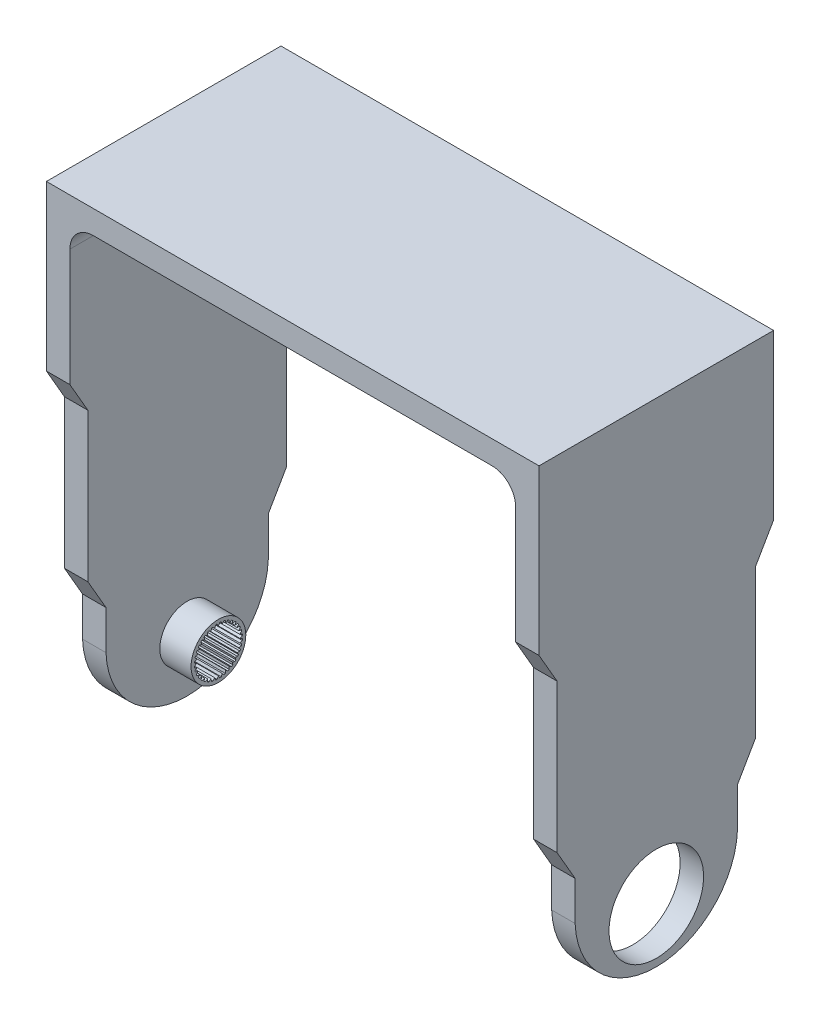
from build123d import *

# Parameters (mm, degrees)
SKETCH1_W            = 63
SKETCH1_H            = 30
BOSS_EXTRUDE1_DEPTH  = 3
SKETCH2_W            = 3
SKETCH2_H            = 30
BOSS_EXTRUDE2_DEPTH  = 60
BOSS_EXTRUDE3_DEPTH  = 4
CUT_EXTRUDE1_DEPTH   = 5
CUT_EXTRUDE2_DEPTH   = 4
FILLET1_R            = 3
FILLET1_OF_MIRROR1_R = 3
SKETCH9_R            = 6.05
CUT_EXTRUDE3_DEPTH   = 10


with BuildPart() as part:
    # Sketch1 → Boss-Extrude1 (new body)
    with BuildSketch(Plane(origin=(0, 0, 0), x_dir=(1, 0, 0), z_dir=(0, 1, 0))):
        Rectangle(SKETCH1_W, SKETCH1_H)
    extrude(amount=BOSS_EXTRUDE1_DEPTH)

    # Sketch2 → Boss-Extrude2 (add)
    with BuildSketch(Plane.XZ):
        with Locations((-30, 0)):
            Rectangle(SKETCH2_W, SKETCH2_H)
    boss_extrude2 = extrude(amount=BOSS_EXTRUDE2_DEPTH)

    # Sketch4 → Boss-Extrude3 (add)
    with BuildSketch(Plane(origin=(-28.5, 0, 0), x_dir=(0, 0, -1), z_dir=(1, 0, 0))):
        with BuildLine():
            ThreePointArc((0, -56.5), (2.474873734, -55.474873734), (3.5, -53))
            ThreePointArc((3.5, -53), (-2.474873734, -50.525126266), (0, -56.5))
        make_face()
    extrude(amount=BOSS_EXTRUDE3_DEPTH)

    # Sketch5 → Cut-Extrude1 (cut)
    with BuildSketch(Plane(origin=(-24.5, 0, 0), x_dir=(0, 0, -1), z_dir=(1, 0, 0))):
        with BuildLine():
            Line((2.458448267, -51.508829992), (2.504760174, -51.428615415))
            Line((2.504760174, -51.428615415), (2.56843672, -51.318324403))
            ThreePointArc((2.56843672, -51.318324403), (2.514796776, -51.23912034), (2.458715244, -51.161625896))
            Line((2.458715244, -51.161625896), (2.333296932, -51.183740528))
            Line((2.333296932, -51.183740528), (2.242080281, -51.199824485))
            Line((2.242080281, -51.199824485), (2.119635244, -51.221414849))
            Line((2.119635244, -51.221414849), (2.162159959, -51.104579154))
            Line((2.162159959, -51.104579154), (2.19383917, -51.017541238))
            Line((2.19383917, -51.017541238), (2.237396492, -50.897868478))
            ThreePointArc((2.237396492, -50.897868478), (2.170817818, -50.829182182), (2.102131522, -50.762603508))
            Line((2.102131522, -50.762603508), (1.982458762, -50.80616083))
            Line((1.982458762, -50.80616083), (1.895420846, -50.837840041))
            Line((1.895420846, -50.837840041), (1.778585151, -50.880364756))
            Line((1.778585151, -50.880364756), (1.800175515, -50.757919719))
            Line((1.800175515, -50.757919719), (1.816259472, -50.666703068))
            Line((1.816259472, -50.666703068), (1.838374104, -50.541284756))
            ThreePointArc((1.838374104, -50.541284756), (1.76087966, -50.485203224), (1.681675597, -50.43156328))
            Line((1.681675597, -50.43156328), (1.571384585, -50.495239826))
            Line((1.571384585, -50.495239826), (1.491170008, -50.541551733))
            Line((1.491170008, -50.541551733), (1.383493649, -50.603718708))
            Line((1.383493649, -50.603718708), (1.383493649, -50.479384758))
            Line((1.383493649, -50.479384758), (1.383493649, -50.386760944))
            Line((1.383493649, -50.386760944), (1.383493649, -50.259407852))
            ThreePointArc((1.383493649, -50.259407852), (1.297438064, -50.217635094), (1.21012281, -50.178563702))
            Line((1.21012281, -50.178563702), (1.112564682, -50.260424691))
            Line((1.112564682, -50.260424691), (1.041610723, -50.319962132))
            Line((1.041610723, -50.319962132), (0.946365392, -50.399882454))
            Line((0.946365392, -50.399882454), (0.924775029, -50.277437417))
            Line((0.924775029, -50.277437417), (0.908691072, -50.186220766))
            Line((0.908691072, -50.186220766), (0.88657644, -50.060802454))
            ThreePointArc((0.88657644, -50.060802454), (0.794574468, -50.034607713), (0.701801054, -50.011292038))
            Line((0.701801054, -50.011292038), (0.619940065, -50.108850167))
            Line((0.619940065, -50.108850167), (0.560402624, -50.179804125))
            Line((0.560402624, -50.179804125), (0.480482302, -50.275049456))
            Line((0.480482302, -50.275049456), (0.437957587, -50.158213761))
            Line((0.437957587, -50.158213761), (0.406278376, -50.071175846))
            Line((0.406278376, -50.071175846), (0.362721054, -49.951503086))
            ThreePointArc((0.362721054, -49.951503086), (0.26756813, -49.941682277), (0.172155428, -49.934830754))
            Line((0.172155428, -49.934830754), (0.108478882, -50.045121766))
            Line((0.108478882, -50.045121766), (0.062166975, -50.125336343))
            Line((0.062166975, -50.125336343), (0, -50.233012702))
            Line((0, -50.233012702), (-0.062166975, -50.125336343))
            Line((-0.062166975, -50.125336343), (-0.108478882, -50.045121766))
            Line((-0.108478882, -50.045121766), (-0.172155428, -49.934830754))
            ThreePointArc((-0.172155428, -49.934830754), (-0.26756813, -49.941682277), (-0.362721054, -49.951503086))
            Line((-0.362721054, -49.951503086), (-0.406278376, -50.071175846))
            Line((-0.406278376, -50.071175846), (-0.437957587, -50.158213761))
            Line((-0.437957587, -50.158213761), (-0.480482302, -50.275049456))
            Line((-0.480482302, -50.275049456), (-0.560402624, -50.179804125))
            Line((-0.560402624, -50.179804125), (-0.619940065, -50.108850167))
            Line((-0.619940065, -50.108850167), (-0.701801054, -50.011292038))
            ThreePointArc((-0.701801054, -50.011292038), (-0.794574468, -50.034607713), (-0.88657644, -50.060802454))
            Line((-0.88657644, -50.060802454), (-0.908691072, -50.186220766))
            Line((-0.908691072, -50.186220766), (-0.924775029, -50.277437417))
            Line((-0.924775029, -50.277437417), (-0.946365392, -50.399882454))
            Line((-0.946365392, -50.399882454), (-1.041610723, -50.319962132))
            Line((-1.041610723, -50.319962132), (-1.112564682, -50.260424691))
            Line((-1.112564682, -50.260424691), (-1.21012281, -50.178563702))
            ThreePointArc((-1.21012281, -50.178563702), (-1.297438064, -50.217635094), (-1.383493649, -50.259407852))
            Line((-1.383493649, -50.259407852), (-1.383493649, -50.386760944))
            Line((-1.383493649, -50.386760944), (-1.383493649, -50.479384758))
            Line((-1.383493649, -50.479384758), (-1.383493649, -50.603718708))
            Line((-1.383493649, -50.603718708), (-1.491170008, -50.541551733))
            Line((-1.491170008, -50.541551733), (-1.571384585, -50.495239826))
            Line((-1.571384585, -50.495239826), (-1.681675597, -50.43156328))
            ThreePointArc((-1.681675597, -50.43156328), (-1.76087966, -50.485203224), (-1.838374104, -50.541284756))
            Line((-1.838374104, -50.541284756), (-1.816259472, -50.666703068))
            Line((-1.816259472, -50.666703068), (-1.800175515, -50.757919719))
            Line((-1.800175515, -50.757919719), (-1.778585151, -50.880364756))
            Line((-1.778585151, -50.880364756), (-1.895420846, -50.837840041))
            Line((-1.895420846, -50.837840041), (-1.982458762, -50.80616083))
            Line((-1.982458762, -50.80616083), (-2.102131522, -50.762603508))
            ThreePointArc((-2.102131522, -50.762603508), (-2.170817818, -50.829182182), (-2.237396492, -50.897868478))
            Line((-2.237396492, -50.897868478), (-2.19383917, -51.017541238))
            Line((-2.19383917, -51.017541238), (-2.162159959, -51.104579154))
            Line((-2.162159959, -51.104579154), (-2.119635244, -51.221414849))
            Line((-2.119635244, -51.221414849), (-2.242080281, -51.199824485))
            Line((-2.242080281, -51.199824485), (-2.333296932, -51.183740528))
            Line((-2.333296932, -51.183740528), (-2.458715244, -51.161625896))
            ThreePointArc((-2.458715244, -51.161625896), (-2.514796776, -51.23912034), (-2.56843672, -51.318324403))
            Line((-2.56843672, -51.318324403), (-2.504760174, -51.428615415))
            Line((-2.504760174, -51.428615415), (-2.458448267, -51.508829992))
            Line((-2.458448267, -51.508829992), (-2.396281292, -51.616506351))
            Line((-2.396281292, -51.616506351), (-2.520615242, -51.616506351))
            Line((-2.520615242, -51.616506351), (-2.613239056, -51.616506351))
            Line((-2.613239056, -51.616506351), (-2.740592148, -51.616506351))
            ThreePointArc((-2.740592148, -51.616506351), (-2.782364906, -51.702561936), (-2.821436298, -51.78987719))
            Line((-2.821436298, -51.78987719), (-2.739575309, -51.887435318))
            Line((-2.739575309, -51.887435318), (-2.680037868, -51.958389277))
            Line((-2.680037868, -51.958389277), (-2.600117546, -52.053634608))
            Line((-2.600117546, -52.053634608), (-2.722562583, -52.075224971))
            Line((-2.722562583, -52.075224971), (-2.813779234, -52.091308928))
            Line((-2.813779234, -52.091308928), (-2.939197546, -52.11342356))
            ThreePointArc((-2.939197546, -52.11342356), (-2.965392287, -52.205425532), (-2.988707962, -52.298198946))
            Line((-2.988707962, -52.298198946), (-2.891149833, -52.380059935))
            Line((-2.891149833, -52.380059935), (-2.820195875, -52.439597376))
            Line((-2.820195875, -52.439597376), (-2.724950544, -52.519517698))
            Line((-2.724950544, -52.519517698), (-2.841786239, -52.562042413))
            Line((-2.841786239, -52.562042413), (-2.928824154, -52.593721624))
            Line((-2.928824154, -52.593721624), (-3.048496914, -52.637278946))
            ThreePointArc((-3.048496914, -52.637278946), (-3.058317723, -52.73243187), (-3.065169246, -52.827844572))
            Line((-3.065169246, -52.827844572), (-2.954878234, -52.891521118))
            Line((-2.954878234, -52.891521118), (-2.874663657, -52.937833025))
            Line((-2.874663657, -52.937833025), (-2.766987298, -53))
            Line((-2.766987298, -53), (-2.874663657, -53.062166975))
            Line((-2.874663657, -53.062166975), (-2.954878234, -53.108478882))
            Line((-2.954878234, -53.108478882), (-3.065169246, -53.172155428))
            ThreePointArc((-3.065169246, -53.172155428), (-3.058317723, -53.26756813), (-3.048496914, -53.362721054))
            Line((-3.048496914, -53.362721054), (-2.928824154, -53.406278376))
            Line((-2.928824154, -53.406278376), (-2.841786239, -53.437957587))
            Line((-2.841786239, -53.437957587), (-2.724950544, -53.480482302))
            Line((-2.724950544, -53.480482302), (-2.820195875, -53.560402624))
            Line((-2.820195875, -53.560402624), (-2.891149833, -53.619940065))
            Line((-2.891149833, -53.619940065), (-2.988707962, -53.701801054))
            ThreePointArc((-2.988707962, -53.701801054), (-2.965392287, -53.794574468), (-2.939197546, -53.88657644))
            Line((-2.939197546, -53.88657644), (-2.813779234, -53.908691072))
            Line((-2.813779234, -53.908691072), (-2.722562583, -53.924775029))
            Line((-2.722562583, -53.924775029), (-2.600117546, -53.946365392))
            Line((-2.600117546, -53.946365392), (-2.680037868, -54.041610723))
            Line((-2.680037868, -54.041610723), (-2.739575309, -54.112564682))
            Line((-2.739575309, -54.112564682), (-2.821436298, -54.21012281))
            ThreePointArc((-2.821436298, -54.21012281), (-2.782364906, -54.297438064), (-2.740592148, -54.383493649))
            Line((-2.740592148, -54.383493649), (-2.613239056, -54.383493649))
            Line((-2.613239056, -54.383493649), (-2.520615242, -54.383493649))
            Line((-2.520615242, -54.383493649), (-2.396281292, -54.383493649))
            Line((-2.396281292, -54.383493649), (-2.458448267, -54.491170008))
            Line((-2.458448267, -54.491170008), (-2.504760174, -54.571384585))
            Line((-2.504760174, -54.571384585), (-2.56843672, -54.681675597))
            ThreePointArc((-2.56843672, -54.681675597), (-2.514796776, -54.76087966), (-2.458715244, -54.838374104))
            Line((-2.458715244, -54.838374104), (-2.333296932, -54.816259472))
            Line((-2.333296932, -54.816259472), (-2.242080281, -54.800175515))
            Line((-2.242080281, -54.800175515), (-2.119635244, -54.778585151))
            Line((-2.119635244, -54.778585151), (-2.162159959, -54.895420846))
            Line((-2.162159959, -54.895420846), (-2.19383917, -54.982458762))
            Line((-2.19383917, -54.982458762), (-2.237396492, -55.102131522))
            ThreePointArc((-2.237396492, -55.102131522), (-2.170817818, -55.170817818), (-2.102131522, -55.237396492))
            Line((-2.102131522, -55.237396492), (-1.982458762, -55.19383917))
            Line((-1.982458762, -55.19383917), (-1.895420846, -55.162159959))
            Line((-1.895420846, -55.162159959), (-1.778585151, -55.119635244))
            Line((-1.778585151, -55.119635244), (-1.800175515, -55.242080281))
            Line((-1.800175515, -55.242080281), (-1.816259472, -55.333296932))
            Line((-1.816259472, -55.333296932), (-1.838374104, -55.458715244))
            ThreePointArc((-1.838374104, -55.458715244), (-1.76087966, -55.514796776), (-1.681675597, -55.56843672))
            Line((-1.681675597, -55.56843672), (-1.571384585, -55.504760174))
            Line((-1.571384585, -55.504760174), (-1.491170008, -55.458448267))
            Line((-1.491170008, -55.458448267), (-1.383493649, -55.396281292))
            Line((-1.383493649, -55.396281292), (-1.383493649, -55.520615242))
            Line((-1.383493649, -55.520615242), (-1.383493649, -55.613239056))
            Line((-1.383493649, -55.613239056), (-1.383493649, -55.740592148))
            ThreePointArc((-1.383493649, -55.740592148), (-1.297438064, -55.782364906), (-1.21012281, -55.821436298))
            Line((-1.21012281, -55.821436298), (-1.112564682, -55.739575309))
            Line((-1.112564682, -55.739575309), (-1.041610723, -55.680037868))
            Line((-1.041610723, -55.680037868), (-0.946365392, -55.600117546))
            Line((-0.946365392, -55.600117546), (-0.924775029, -55.722562583))
            Line((-0.924775029, -55.722562583), (-0.908691072, -55.813779234))
            Line((-0.908691072, -55.813779234), (-0.88657644, -55.939197546))
            ThreePointArc((-0.88657644, -55.939197546), (-0.794574468, -55.965392287), (-0.701801054, -55.988707962))
            Line((-0.701801054, -55.988707962), (-0.619940065, -55.891149833))
            Line((-0.619940065, -55.891149833), (-0.560402624, -55.820195875))
            Line((-0.560402624, -55.820195875), (-0.480482302, -55.724950544))
            Line((-0.480482302, -55.724950544), (-0.437957587, -55.841786239))
            Line((-0.437957587, -55.841786239), (-0.406278376, -55.928824154))
            Line((-0.406278376, -55.928824154), (-0.362721054, -56.048496914))
            ThreePointArc((-0.362721054, -56.048496914), (-0.26756813, -56.058317723), (-0.172155428, -56.065169246))
            Line((-0.172155428, -56.065169246), (-0.108478882, -55.954878234))
            Line((-0.108478882, -55.954878234), (-0.062166975, -55.874663657))
            Line((-0.062166975, -55.874663657), (0, -55.766987298))
            Line((0, -55.766987298), (0.062166975, -55.874663657))
            Line((0.062166975, -55.874663657), (0.108478882, -55.954878234))
            Line((0.108478882, -55.954878234), (0.172155428, -56.065169246))
            ThreePointArc((0.172155428, -56.065169246), (0.26756813, -56.058317723), (0.362721054, -56.048496914))
            Line((0.362721054, -56.048496914), (0.406278376, -55.928824154))
            Line((0.406278376, -55.928824154), (0.437957587, -55.841786239))
            Line((0.437957587, -55.841786239), (0.480482302, -55.724950544))
            Line((0.480482302, -55.724950544), (0.560402624, -55.820195875))
            Line((0.560402624, -55.820195875), (0.619940065, -55.891149833))
            Line((0.619940065, -55.891149833), (0.701801054, -55.988707962))
            ThreePointArc((0.701801054, -55.988707962), (0.794574468, -55.965392287), (0.88657644, -55.939197546))
            Line((0.88657644, -55.939197546), (0.908691072, -55.813779234))
            Line((0.908691072, -55.813779234), (0.924775029, -55.722562583))
            Line((0.924775029, -55.722562583), (0.946365392, -55.600117546))
            Line((0.946365392, -55.600117546), (1.041610723, -55.680037868))
            Line((1.041610723, -55.680037868), (1.112564682, -55.739575309))
            Line((1.112564682, -55.739575309), (1.21012281, -55.821436298))
            ThreePointArc((1.21012281, -55.821436298), (1.297438064, -55.782364906), (1.383493649, -55.740592148))
            Line((1.383493649, -55.740592148), (1.383493649, -55.613239056))
            Line((1.383493649, -55.613239056), (1.383493649, -55.520615242))
            Line((1.383493649, -55.520615242), (1.383493649, -55.396281292))
            Line((1.383493649, -55.396281292), (1.491170008, -55.458448267))
            Line((1.491170008, -55.458448267), (1.571384585, -55.504760174))
            Line((1.571384585, -55.504760174), (1.681675597, -55.56843672))
            ThreePointArc((1.681675597, -55.56843672), (1.76087966, -55.514796776), (1.838374104, -55.458715244))
            Line((1.838374104, -55.458715244), (1.816259472, -55.333296932))
            Line((1.816259472, -55.333296932), (1.800175515, -55.242080281))
            Line((1.800175515, -55.242080281), (1.778585151, -55.119635244))
            Line((1.778585151, -55.119635244), (1.895420846, -55.162159959))
            Line((1.895420846, -55.162159959), (1.982458762, -55.19383917))
            Line((1.982458762, -55.19383917), (2.102131522, -55.237396492))
            ThreePointArc((2.102131522, -55.237396492), (2.170817818, -55.170817818), (2.237396492, -55.102131522))
            Line((2.237396492, -55.102131522), (2.19383917, -54.982458762))
            Line((2.19383917, -54.982458762), (2.162159959, -54.895420846))
            Line((2.162159959, -54.895420846), (2.119635244, -54.778585151))
            Line((2.119635244, -54.778585151), (2.242080281, -54.800175515))
            Line((2.242080281, -54.800175515), (2.333296932, -54.816259472))
            Line((2.333296932, -54.816259472), (2.458715244, -54.838374104))
            ThreePointArc((2.458715244, -54.838374104), (2.514796776, -54.76087966), (2.56843672, -54.681675597))
            Line((2.56843672, -54.681675597), (2.504760174, -54.571384585))
            Line((2.504760174, -54.571384585), (2.458448267, -54.491170008))
            Line((2.458448267, -54.491170008), (2.396281292, -54.383493649))
            Line((2.396281292, -54.383493649), (2.520615242, -54.383493649))
            Line((2.520615242, -54.383493649), (2.613239056, -54.383493649))
            Line((2.613239056, -54.383493649), (2.740592148, -54.383493649))
            ThreePointArc((2.740592148, -54.383493649), (2.782364906, -54.297438064), (2.821436298, -54.21012281))
            Line((2.821436298, -54.21012281), (2.739575309, -54.112564682))
            Line((2.739575309, -54.112564682), (2.680037868, -54.041610723))
            Line((2.680037868, -54.041610723), (2.600117546, -53.946365392))
            Line((2.600117546, -53.946365392), (2.722562583, -53.924775029))
            Line((2.722562583, -53.924775029), (2.813779234, -53.908691072))
            Line((2.813779234, -53.908691072), (2.939197546, -53.88657644))
            ThreePointArc((2.939197546, -53.88657644), (2.965392287, -53.794574468), (2.988707962, -53.701801054))
            Line((2.988707962, -53.701801054), (2.891149833, -53.619940065))
            Line((2.891149833, -53.619940065), (2.820195875, -53.560402624))
            Line((2.820195875, -53.560402624), (2.724950544, -53.480482302))
            Line((2.724950544, -53.480482302), (2.841786239, -53.437957587))
            Line((2.841786239, -53.437957587), (2.928824154, -53.406278376))
            Line((2.928824154, -53.406278376), (3.048496914, -53.362721054))
            ThreePointArc((3.048496914, -53.362721054), (3.058317723, -53.26756813), (3.065169246, -53.172155428))
            Line((3.065169246, -53.172155428), (2.954878234, -53.108478882))
            Line((2.954878234, -53.108478882), (2.874663657, -53.062166975))
            Line((2.874663657, -53.062166975), (2.766987298, -53))
            Line((2.766987298, -53), (2.874663657, -52.937833025))
            Line((2.874663657, -52.937833025), (2.954878234, -52.891521118))
            Line((2.954878234, -52.891521118), (3.065169246, -52.827844572))
            ThreePointArc((3.065169246, -52.827844572), (3.058317723, -52.73243187), (3.048496914, -52.637278946))
            Line((3.048496914, -52.637278946), (2.928824154, -52.593721624))
            Line((2.928824154, -52.593721624), (2.841786239, -52.562042413))
            Line((2.841786239, -52.562042413), (2.724950544, -52.519517698))
            Line((2.724950544, -52.519517698), (2.820195875, -52.439597376))
            Line((2.820195875, -52.439597376), (2.891149833, -52.380059935))
            Line((2.891149833, -52.380059935), (2.988707962, -52.298198946))
            ThreePointArc((2.988707962, -52.298198946), (2.965392287, -52.205425532), (2.939197546, -52.11342356))
            Line((2.939197546, -52.11342356), (2.813779234, -52.091308928))
            Line((2.813779234, -52.091308928), (2.722562583, -52.075224971))
            Line((2.722562583, -52.075224971), (2.600117546, -52.053634608))
            Line((2.600117546, -52.053634608), (2.680037868, -51.958389277))
            Line((2.680037868, -51.958389277), (2.739575309, -51.887435318))
            Line((2.739575309, -51.887435318), (2.821436298, -51.78987719))
            ThreePointArc((2.821436298, -51.78987719), (2.782364906, -51.702561936), (2.740592148, -51.616506351))
            Line((2.740592148, -51.616506351), (2.613239056, -51.616506351))
            Line((2.613239056, -51.616506351), (2.520615242, -51.616506351))
            Line((2.520615242, -51.616506351), (2.396281292, -51.616506351))
            Line((2.396281292, -51.616506351), (2.458448267, -51.508829992))
        make_face()
    extrude(amount=-CUT_EXTRUDE1_DEPTH, mode=Mode.SUBTRACT)

    # Sketch6 → Cut-Extrude2 (cut)
    with BuildSketch(Plane(origin=(-28.5, 0, 0), x_dir=(0, 0, -1), z_dir=(1, 0, 0))):
        with BuildLine():
            ThreePointArc((10.381197846, -50), (7.207101855, -57.093371594), (-6e-09, -60))
            Line((-6e-09, -60), (15, -60))
            Line((15, -60), (15, -18))
            Line((15, -18), (12.690598923, -22))
            Line((12.690598923, -22), (12.690598923, -41))
            Line((12.690598923, -41), (10.381197846, -45))
            Line((10.381197846, -45), (10.381197846, -50))
        make_face()
        with BuildLine():
            Line((-12.690598923, -22), (-15, -18))
            Line((-15, -18), (-15, -60))
            Line((-15, -60), (-6e-09, -60))
            ThreePointArc((-6e-09, -60), (-7.20710186, -57.093371589), (-10.381197846, -50))
            Line((-10.381197846, -50), (-10.381197846, -45))
            Line((-10.381197846, -45), (-12.690598923, -41))
            Line((-12.690598923, -41), (-12.690598923, -22))
        make_face()
    cut_extrude2 = extrude(amount=-CUT_EXTRUDE2_DEPTH, mode=Mode.SUBTRACT)

    # Fillet1
    fillet1_edges = [part.edges().sort_by_distance(p)[0] for p in [
        (-28.5, 0, 0),
    ]]
    fillet(fillet1_edges, radius=FILLET1_R)

    # Mirror1: Boss-Extrude2, Cut-Extrude2 across plane
    add(boss_extrude2.mirror(Plane(origin=(0, 0, 0), x_dir=(0, 0, 1), z_dir=(1, 0, 0))))
    add(cut_extrude2.mirror(Plane(origin=(0, 0, 0), x_dir=(0, 0, 1), z_dir=(1, 0, 0))), mode=Mode.SUBTRACT)

    # Fillet1 of Mirror1
    fillet1_of_mirror1_edges = [part.edges().sort_by_distance(p)[0] for p in [
        (28.5, 0, 0),
    ]]
    fillet(fillet1_of_mirror1_edges, radius=FILLET1_OF_MIRROR1_R)

    # Sketch9 → Cut-Extrude3 (cut)
    with BuildSketch(Plane.ZY.offset(-28.5)):
        with Locations((0, -53)):
            Circle(SKETCH9_R)
    extrude(amount=-CUT_EXTRUDE3_DEPTH, mode=Mode.SUBTRACT)


solid = part.part
